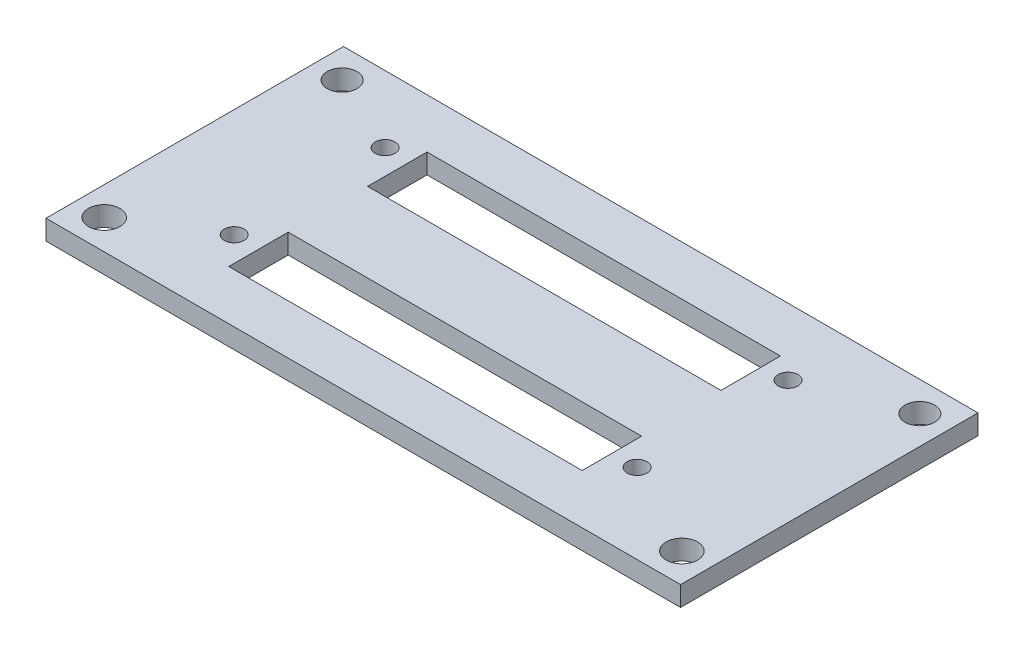
from build123d import *

# Parameters (mm, degrees)
SKETCH2_W           = 64
SKETCH2_H           = 30
SKETCH2_R           = 1.589304783
SKETCH2_R_2         = 1.5
BOSS_EXTRUDE1_DEPTH = 2
SKETCH3_R           = 1
SKETCH3_W           = 35.640445049
SKETCH3_H           = 6
CUT_EXTRUDE1_DEPTH  = 2


with BuildPart() as part:
    # Sketch2 → Boss-Extrude1 (new body)
    with BuildSketch(Plane(origin=(0, 0, 0), x_dir=(1, 0, 0), z_dir=(0, 1, 0))):
        Rectangle(SKETCH2_W, SKETCH2_H)
        with Locations(Location((-29.13, -12, 0), (0, 0, 270))):
            Circle(SKETCH2_R, mode=Mode.SUBTRACT)
        with Locations(Location((-29.134119409, 12, 0), (0, 0, 270))):
            Circle(SKETCH2_R_2, mode=Mode.SUBTRACT)
        with Locations(Location((29.13, -12, 0), (0, 0, 90))):
            Circle(SKETCH2_R, mode=Mode.SUBTRACT)
        with Locations(Location((29.134119409, 12, 0), (0, 0, 90))):
            Circle(SKETCH2_R_2, mode=Mode.SUBTRACT)
    extrude(amount=BOSS_EXTRUDE1_DEPTH)

    # Sketch3 → Cut-Extrude1 (cut)
    with BuildSketch(Plane(origin=(0, 2, 0), x_dir=(1, 0, 0), z_dir=(0, 1, 0))):
        with Locations(Location((-21.068550994, 8.267170413, 0), (0, 0, 270))):
            Circle(SKETCH3_R)
        with Locations(Location((19.571449006, 8.267170413, 0), (0, 0, 90))):
            Circle(SKETCH3_R)
        with Locations(Location((19.571449006, -6.952829587, 0), (0, 0, 270))):
            Circle(SKETCH3_R)
        with Locations(Location((-21.068550994, -6.952829587, 0), (0, 0, 90))):
            Circle(SKETCH3_R)
        with Locations((-0.74832847, -7)):
            Rectangle(SKETCH3_W, SKETCH3_H)
        with Locations((-0.74832847, 7)):
            Rectangle(SKETCH3_W, SKETCH3_H)
    extrude(amount=-CUT_EXTRUDE1_DEPTH, mode=Mode.SUBTRACT)


solid = part.part
